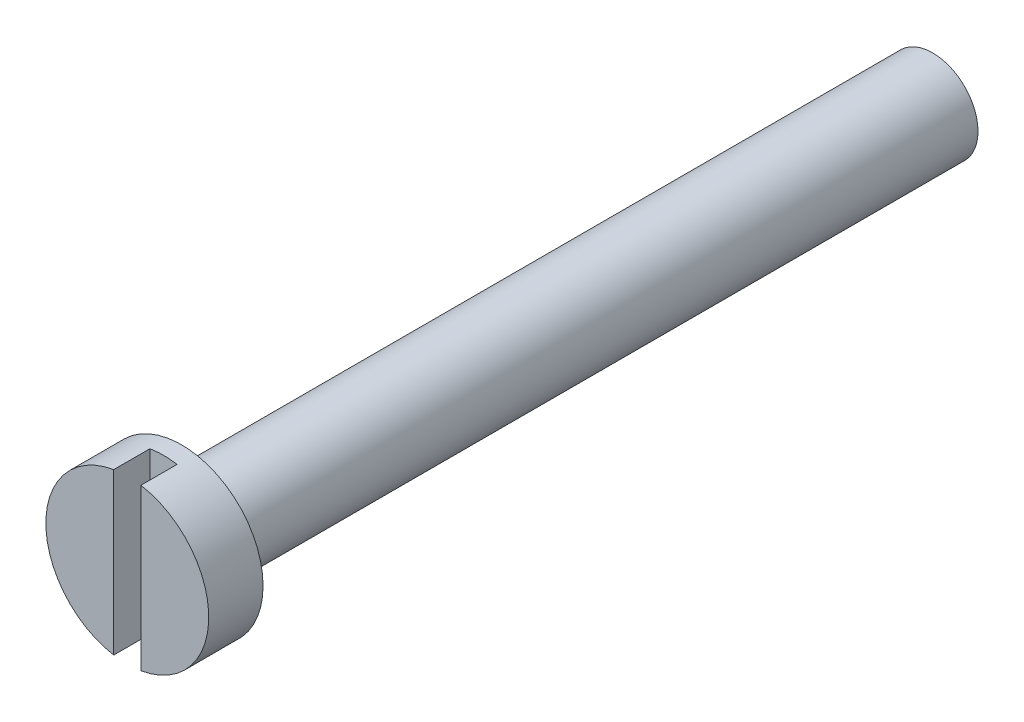
from build123d import *

# Parameters (mm, degrees)
SKETCH_1_R             = 2.5
EXTRUDE_1_DEPTH        = 41.5
SKETCH_2_R             = 4.5
EXTRUDE_2_DEPTH        = 3
SKETCH_4_W             = 1.5
SKETCH_4_H             = 10.936891942
CUT_EXTRUDE_1_DEPTH    = 2
HOLE_WIZARD_M3_1_D     = 2.5
HOLE_WIZARD_M3_1_DEPTH = 10
HOLE_WIZARD_M3_1_TIP   = 0.751075774


with BuildPart() as part:
    # 草图1 → 凸台-拉伸1 (new body)
    with BuildSketch(Plane.XY):
        Circle(SKETCH_1_R)
    extrude(amount=EXTRUDE_1_DEPTH)

    # 草图2 → 凸台-拉伸2 (add)
    with BuildSketch(Plane.XY.offset(41.5)):
        Circle(SKETCH_2_R)
    extrude(amount=EXTRUDE_2_DEPTH)

    # 草图4 → 切除-拉伸1 (cut)
    with BuildSketch(Plane.XY.offset(44.5)):
        Rectangle(SKETCH_4_W, SKETCH_4_H)
    extrude(amount=-CUT_EXTRUDE_1_DEPTH, mode=Mode.SUBTRACT)

    # M3 螺纹孔的螺纹孔钻头1
    with Locations(Plane(origin=(0, 0, 0), x_dir=(-1, 0, 0), z_dir=(0, 0, -1))):
        with Locations((0, 0)):
            Hole(HOLE_WIZARD_M3_1_D / 2, depth=HOLE_WIZARD_M3_1_DEPTH)
            with Locations((0, 0, -(HOLE_WIZARD_M3_1_DEPTH + HOLE_WIZARD_M3_1_TIP / 2))):  # 118° drill point
                Cone(0, HOLE_WIZARD_M3_1_D / 2, HOLE_WIZARD_M3_1_TIP, mode=Mode.SUBTRACT)


solid = part.part
